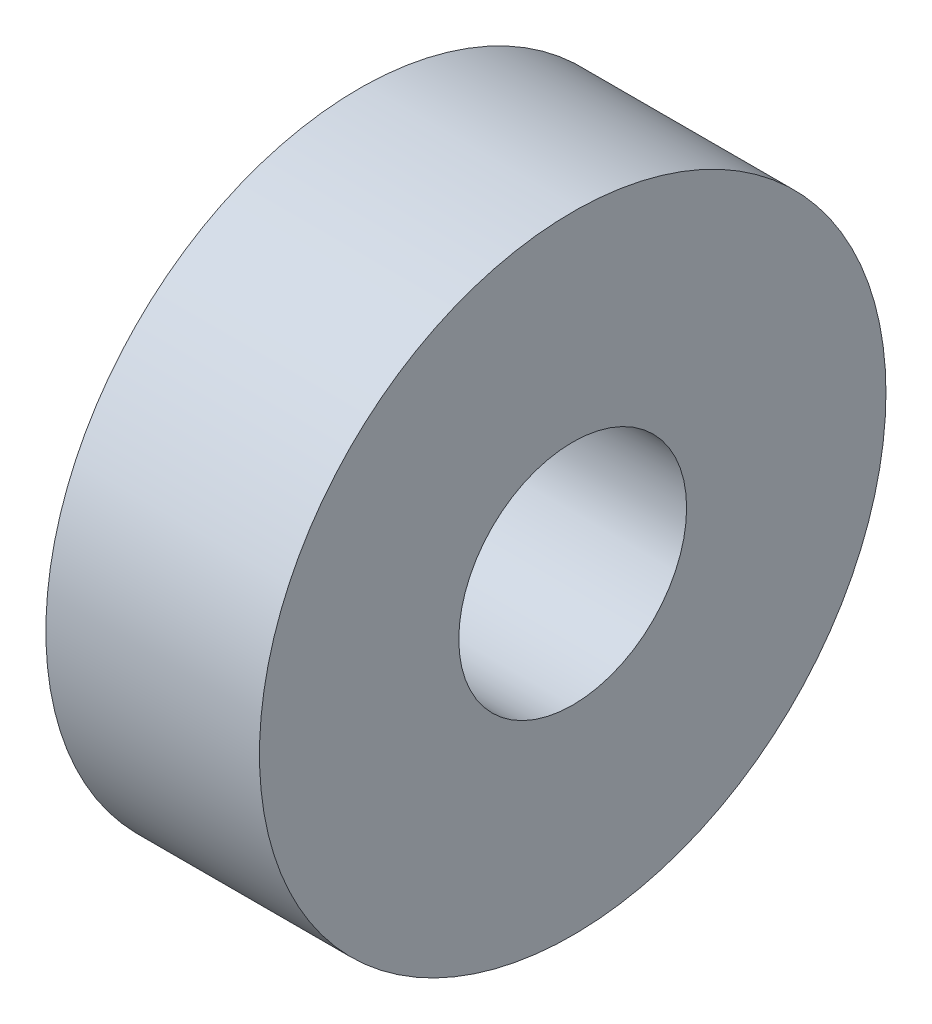
from build123d import *

# Parameters (mm, degrees)
SKETCH1_R           = 11
SKETCH1_R_2         = 4
BOSS_EXTRUDE1_DEPTH = 7.5


with BuildPart() as part:
    # Sketch1 → Boss-Extrude1 (new body)
    with BuildSketch(Plane(origin=(0, 0, 0), x_dir=(0, 0, -1), z_dir=(1, 0, 0))):
        Circle(SKETCH1_R)
        Circle(SKETCH1_R_2, mode=Mode.SUBTRACT)
    extrude(amount=BOSS_EXTRUDE1_DEPTH)


solid = part.part
